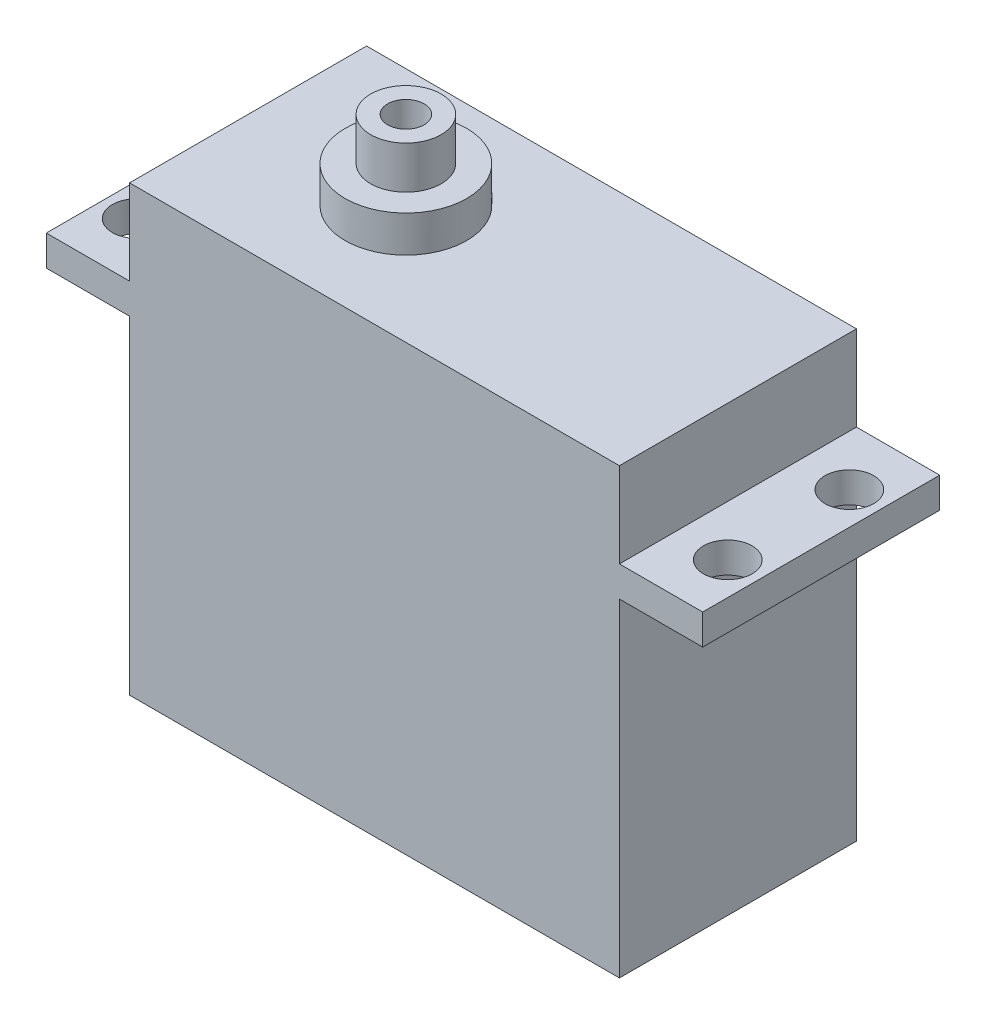
from build123d import *

# Parameters (mm, degrees)
SKETCH_1_W          = 40.3
SKETCH_1_H          = 19.5
EXTRUDE_1_DEPTH     = 27
SKETCH_2_W          = 54
SKETCH_2_H          = 19.5
EXTRUDE_2_DEPTH     = 2.5
CUT_EXTRUDE_1_REACH = 43.162
SKETCH_3_R          = 2
SKETCH_4_W          = 40.3
SKETCH_4_H          = 19.5
EXTRUDE_3_DEPTH     = 7
SKETCH_6_R          = 2.9
SKETCH_6_R_2        = 1.5
EXTRUDE_4_DEPTH     = 6.5
SKETCH_7_R          = 5
SKETCH_7_R_2        = 2.9
EXTRUDE_5_DEPTH     = 3
SKETCH_8_W          = 6.989880398
SKETCH_8_H          = 3.148594774
EXTRUDE_6_DEPTH     = 6


with BuildPart() as part:
    # 草图1 → 凸台-拉伸1 (new body)
    with BuildSketch(Plane(origin=(0, 0, 0), x_dir=(1, 0, 0), z_dir=(0, 1, 0))):
        Rectangle(SKETCH_1_W, SKETCH_1_H)
    extrude(amount=EXTRUDE_1_DEPTH)

    # 草图2 → 凸台-拉伸2 (add)
    with BuildSketch(Plane(origin=(0, 27, 0), x_dir=(1, 0, 0), z_dir=(0, 1, 0))):
        Rectangle(SKETCH_2_W, SKETCH_2_H)
    extrude(amount=EXTRUDE_2_DEPTH)

    # 草图3 → 切除-拉伸1 (cut, up to next)
    with BuildSketch(Plane(origin=(0, 29.5, 0), x_dir=(1, 0, 0), z_dir=(0, 1, 0)), mode=Mode.PRIVATE) as cut_extrude_1_sk1:
        with Locations(Location((24.315, 5, 0), (0, 0, 270))):
            Circle(SKETCH_3_R)
    cut_extrude_1_tool1 = extrude(cut_extrude_1_sk1.sketch, amount=-CUT_EXTRUDE_1_REACH, mode=Mode.PRIVATE) & part.part
    # 草图3 → 切除-拉伸1 (cut, up to next)
    with BuildSketch(Plane(origin=(0, 29.5, 0), x_dir=(1, 0, 0), z_dir=(0, 1, 0)), mode=Mode.PRIVATE) as cut_extrude_1_sk2:
        with Locations(Location((-24.315, 5, 0), (0, 0, 90))):
            Circle(SKETCH_3_R)
    cut_extrude_1_tool2 = extrude(cut_extrude_1_sk2.sketch, amount=-CUT_EXTRUDE_1_REACH, mode=Mode.PRIVATE) & part.part
    # 草图3 → 切除-拉伸1 (cut, up to next)
    with BuildSketch(Plane(origin=(0, 29.5, 0), x_dir=(1, 0, 0), z_dir=(0, 1, 0)), mode=Mode.PRIVATE) as cut_extrude_1_sk3:
        with Locations(Location((24.315, -5, 0), (0, 0, 90))):
            Circle(SKETCH_3_R)
    cut_extrude_1_tool3 = extrude(cut_extrude_1_sk3.sketch, amount=-CUT_EXTRUDE_1_REACH, mode=Mode.PRIVATE) & part.part
    # 草图3 → 切除-拉伸1 (cut, up to next)
    with BuildSketch(Plane(origin=(0, 29.5, 0), x_dir=(1, 0, 0), z_dir=(0, 1, 0)), mode=Mode.PRIVATE) as cut_extrude_1_sk4:
        with Locations(Location((-24.315, -5, 0), (0, 0, 270))):
            Circle(SKETCH_3_R)
    cut_extrude_1_tool4 = extrude(cut_extrude_1_sk4.sketch, amount=-CUT_EXTRUDE_1_REACH, mode=Mode.PRIVATE) & part.part
    add(cut_extrude_1_tool1.solids().sort_by_distance((24.315, 29.5, -5))[0], mode=Mode.SUBTRACT)
    add(cut_extrude_1_tool2.solids().sort_by_distance((-24.315, 29.5, -5))[0], mode=Mode.SUBTRACT)
    add(cut_extrude_1_tool3.solids().sort_by_distance((24.315, 29.5, 5))[0], mode=Mode.SUBTRACT)
    add(cut_extrude_1_tool4.solids().sort_by_distance((-24.315, 29.5, 5))[0], mode=Mode.SUBTRACT)

    # 草图4 → 凸台-拉伸3 (add)
    with BuildSketch(Plane(origin=(0, 29.5, 0), x_dir=(1, 0, 0), z_dir=(0, 1, 0))):
        Rectangle(SKETCH_4_W, SKETCH_4_H)
    extrude(amount=EXTRUDE_3_DEPTH)

    # 草图6 → 凸台-拉伸4 (add)
    with BuildSketch(Plane(origin=(0, 36.5, 0), x_dir=(1, 0, 0), z_dir=(0, 1, 0))):
        with Locations(Location((-7.165, 0, 0), (0, 0, 90))):
            Circle(SKETCH_6_R)
        with Locations(Location((-7.165, 0, 0), (0, 0, 90))):
            Circle(SKETCH_6_R_2, mode=Mode.SUBTRACT)
    extrude(amount=EXTRUDE_4_DEPTH)

    # 草图7 → 凸台-拉伸5 (add)
    with BuildSketch(Plane(origin=(0, 36.5, 0), x_dir=(1, 0, 0), z_dir=(0, 1, 0))):
        with Locations(Location((-7.165, 0, 0), (0, 0, 90))):
            Circle(SKETCH_7_R)
        with Locations(Location((-7.165, 0, 0), (0, 0, 90))):
            Circle(SKETCH_7_R_2, mode=Mode.SUBTRACT)
    extrude(amount=EXTRUDE_5_DEPTH)

    # 草图8 → 凸台-拉伸6 (add)
    with BuildSketch(Plane.ZY.offset(20.15)):
        with Locations((0, 3.490037893)):
            Rectangle(SKETCH_8_W, SKETCH_8_H)
    extrude(amount=EXTRUDE_6_DEPTH)


solid = part.part
